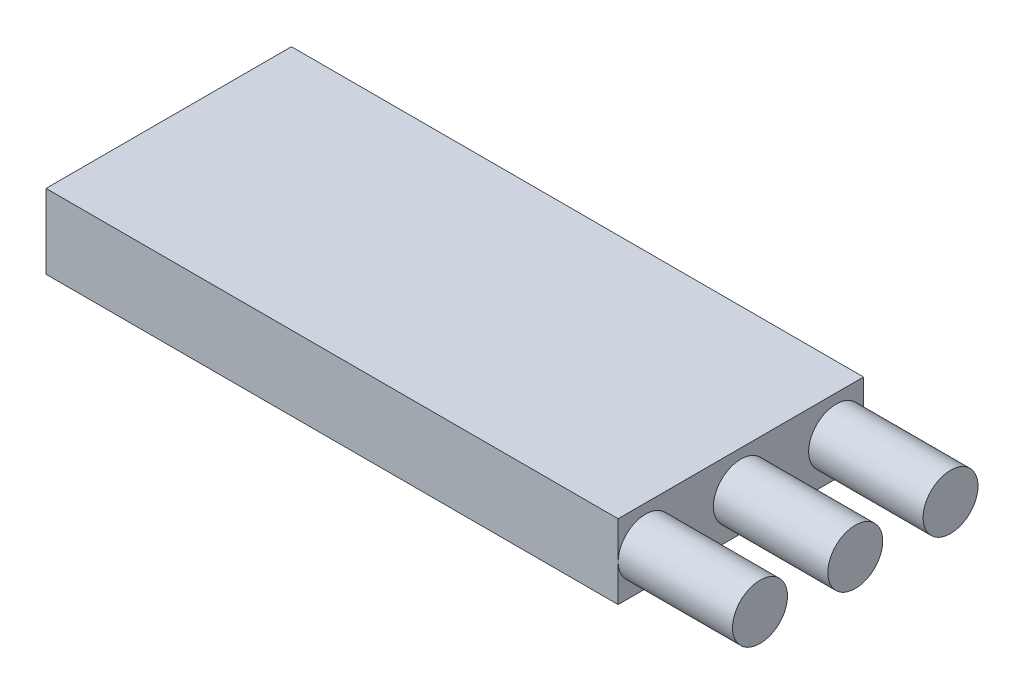
from build123d import *

# Parameters (mm, degrees)
SKETCH1_W           = 50
SKETCH1_H           = 21.45
BOSS_EXTRUDE1_DEPTH = 6.5
SKETCH2_R           = 2.4
BOSS_EXTRUDE2_DEPTH = 10


with BuildPart() as part:
    # Sketch1 → Boss-Extrude1 (new body)
    with BuildSketch(Plane(origin=(0, 0, 0), x_dir=(1, 0, 0), z_dir=(0, 1, 0))):
        with Locations((25, 10.725)):
            Rectangle(SKETCH1_W, SKETCH1_H)
    extrude(amount=BOSS_EXTRUDE1_DEPTH)

    # Sketch2 → Boss-Extrude2 (add)
    with BuildSketch(Plane(origin=(50, 0, 0), x_dir=(0, 0, -1), z_dir=(1, 0, 0))):
        with Locations((10.725, 3.25)):
            Circle(SKETCH2_R)
        with Locations(Location((2.4, 3.25, 0), (0, 0, 180))):
            Circle(SKETCH2_R)
        with Locations((19.05, 3.25)):
            Circle(SKETCH2_R)
    extrude(amount=BOSS_EXTRUDE2_DEPTH)


solid = part.part
